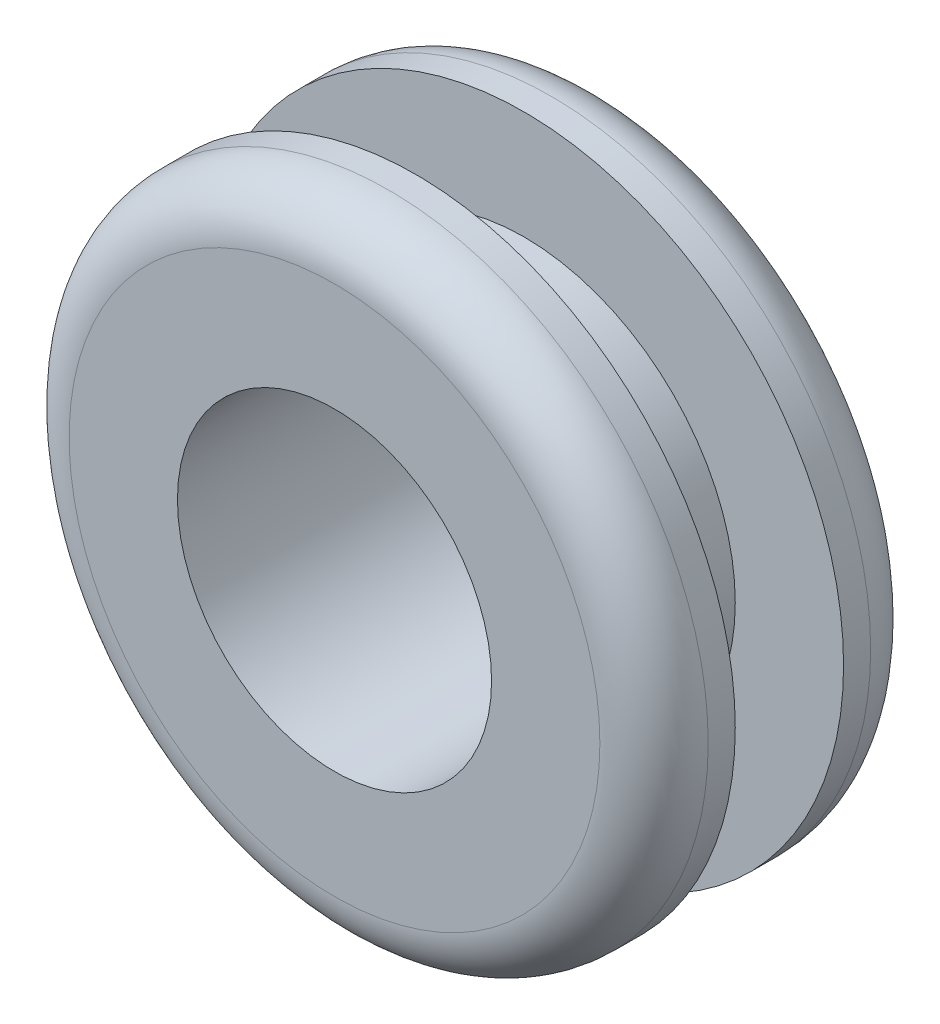
from build123d import *


with BuildPart() as part:
    # Çizim2 → Döndür2 (revolve)
    with BuildSketch(Plane(origin=(0, 0, 0), x_dir=(0, 0, -1), z_dir=(0, 1, 0)), mode=Mode.PRIVATE) as d_nd_r2_sk:
        with BuildLine():
            Line((-2.5, 2.9), (2.5, 2.9))
            Line((2.5, 2.9), (2.5, 4.9))
            ThreePointArc((2.5, 4.9), (2.207106781, 5.607106781), (1.5, 5.9))
            Line((1.5, 5.9), (1, 5.9))
            Line((1, 5.9), (1, 3.9))
            Line((1, 3.9), (-1, 3.9))
            Line((-1, 3.9), (-1, 5.9))
            Line((-1, 5.9), (-1.5, 5.9))
            ThreePointArc((-1.5, 5.9), (-2.207106781, 5.607106781), (-2.5, 4.9))
            Line((-2.5, 4.9), (-2.5, 2.9))
        make_face()
    revolve(d_nd_r2_sk.sketch.rotate(Axis((0, 0, 0), (0, 0, -1)), 180), axis=Axis((0, 0, 0), (0, 0, -1)))


solid = part.part
